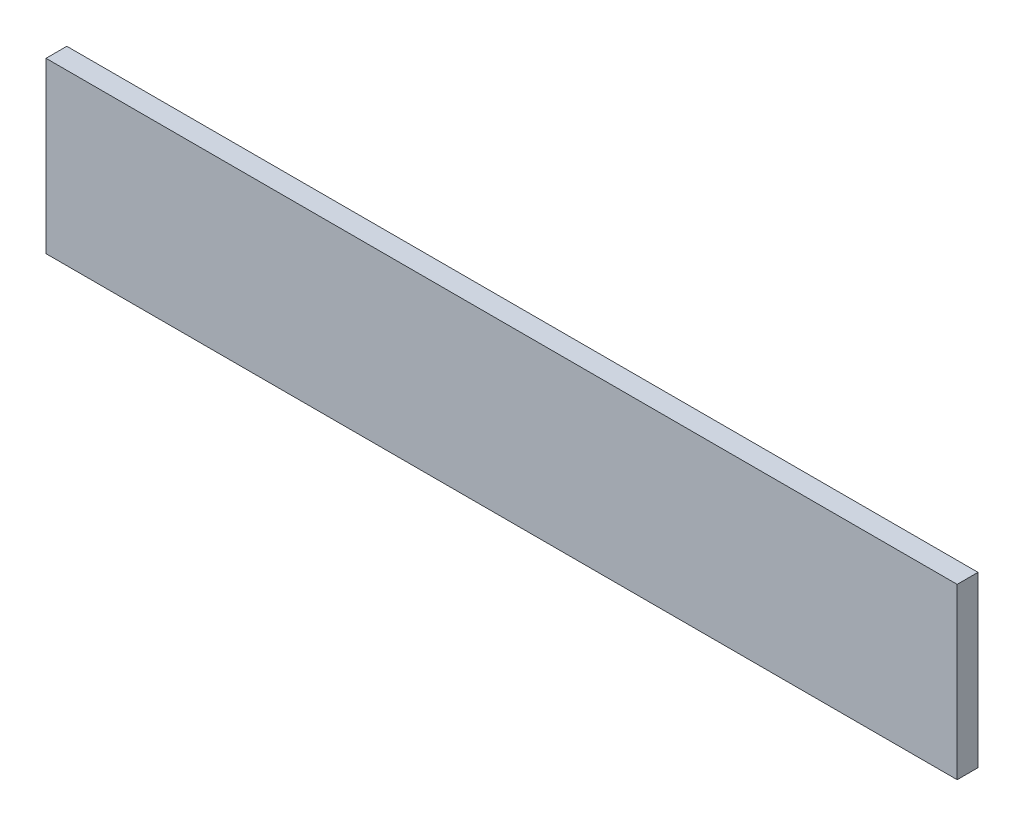
from build123d import *

# Parameters (mm, degrees)
SKETCH1_W           = 70
SKETCH1_H           = 13
BOSS_EXTRUDE1_DEPTH = 1.6


with BuildPart() as part:
    # Sketch1 → Boss-Extrude1 (new body)
    with BuildSketch(Plane.XY):
        Rectangle(SKETCH1_W, SKETCH1_H)
    extrude(amount=BOSS_EXTRUDE1_DEPTH)


solid = part.part
